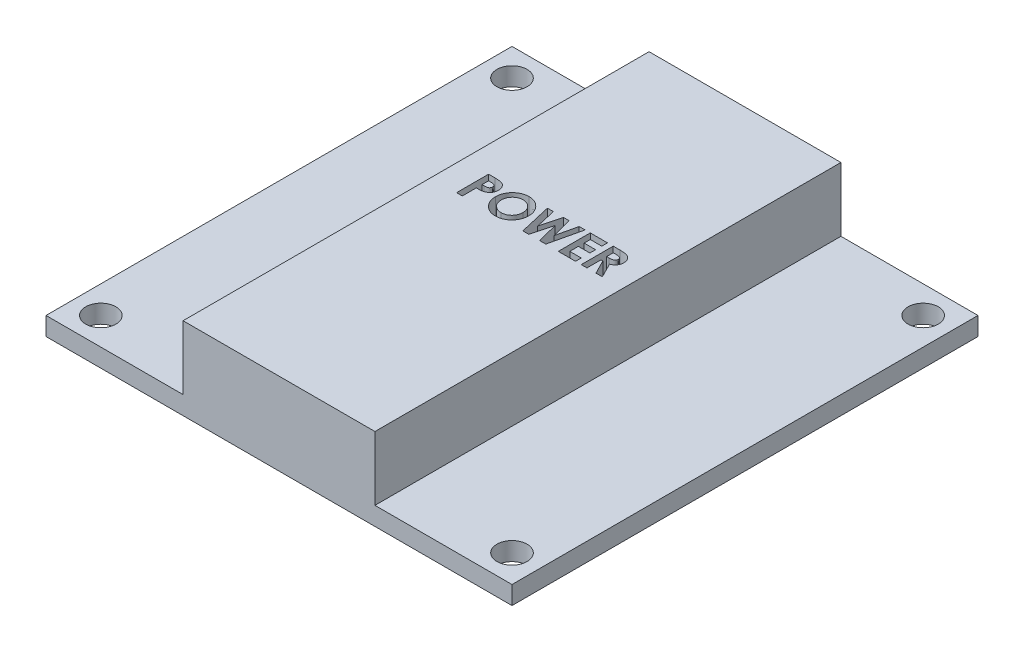
from build123d import *

# Parameters (mm, degrees)
SKETCH1_W           = 51
SKETCH1_H           = 51
SKETCH1_R           = 1.65
BOSS_EXTRUDE1_DEPTH = 9
CUT_EXTRUDE1_DEPTH  = 7
CUT_EXTRUDE2_DEPTH  = 5


with BuildPart() as part:
    # Sketch1 → Boss-Extrude1 (new body)
    with BuildSketch(Plane(origin=(0, 0, 0), x_dir=(1, 0, 0), z_dir=(0, 1, 0))):
        with Locations((5.5, -6.085166225)):
            Rectangle(SKETCH1_W, SKETCH1_H)
        with Locations(Location((-17, 16.414833775, 0), (0, 0, 270))):
            Circle(SKETCH1_R, mode=Mode.SUBTRACT)
        with Locations(Location((28, 16.414833775, 0), (0, 0, 270))):
            Circle(SKETCH1_R, mode=Mode.SUBTRACT)
        with Locations(Location((28, -28.585166225, 0), (0, 0, 270))):
            Circle(SKETCH1_R, mode=Mode.SUBTRACT)
        with Locations(Location((-17, -28.585166225, 0), (0, 0, 270))):
            Circle(SKETCH1_R, mode=Mode.SUBTRACT)
    extrude(amount=BOSS_EXTRUDE1_DEPTH)

    # Sketch2 → Cut-Extrude1 (cut)
    with BuildSketch(Plane(origin=(0, 9, 0), x_dir=(1, 0, 0), z_dir=(0, 1, 0))):
        Polygon((-5, 4.414833775), (-5, -16.585166225), (-5, -31.585166225), (-20, -31.585166225), (-20, 19.414833775), (-5, 19.414833775), align=None)
        Polygon((31, 19.414833775), (31, -31.585166225), (16, -31.585166225), (16, -16.585166225), (16, 4.414833775), (16, 19.414833775), align=None)
    extrude(amount=-CUT_EXTRUDE1_DEPTH, mode=Mode.SUBTRACT)

    # Sketch3 → Cut-Extrude2 (cut)
    # profile 1 of 5: a face of its own
    with BuildSketch(Plane(origin=(0, 9, 0), x_dir=(1, 0, 0), z_dir=(0, 1, 0))):
        with BuildLine():
            Line((-2.170736551, -0.977395332), (-1.469614757, -0.977395332))
            add(Edge.make_bspline(
                [(-1.469614757, -0.977395332), (-1.423804368, -0.977600389), (-1.335426526, -0.977995987), (-1.207978407, -0.98279314), (-1.090401277, -0.991389929), (-0.982722149, -1.002014201), (-0.884985298, -1.016909017), (-0.797068329, -1.033984757), (-0.718952996, -1.054787978), (-0.649758433, -1.079481113), (-0.587658547, -1.108593355), (-0.528892027, -1.139599971), (-0.474787001, -1.176605273), (-0.422612625, -1.215620988), (-0.375351799, -1.26037427), (-0.33005611, -1.307886726), (-0.288643952, -1.360042659), (-0.250923439, -1.416210735), (-0.21670512, -1.47535321), (-0.186809708, -1.537575812), (-0.162560224, -1.602977002), (-0.142217923, -1.671133709), (-0.125878788, -1.742042961), (-0.115002939, -1.816140859), (-0.107615516, -1.892910021), (-0.106963678, -1.945159161), (-0.106633987, -1.971586037)],
                knots=[0, 0, 0, 0, 1.698747864, 3.27724071, 4.728299578, 6.070144658, 7.288476769, 8.393259625, 9.389771311, 10.283485332, 11.113357557, 11.931608583, 12.74405601, 13.541433047, 14.344816069, 15.154114104, 15.974336324, 16.810834471, 17.661136416, 18.50621059, 19.367396281, 20.244825668, 21.142564693, 22.063065223, 23.020325768, 24, 24, 24, 24], degree=3))
            add(Edge.make_bspline(
                [(-0.106633987, -1.971586037), (-0.107111008, -2.000821461), (-0.108048413, -2.058272663), (-0.117237999, -2.142489075), (-0.132936716, -2.2227818), (-0.153454118, -2.29982796), (-0.182064175, -2.372359974), (-0.214749823, -2.442108479), (-0.254963537, -2.507117941), (-0.300914134, -2.56820155), (-0.351097428, -2.625855945), (-0.406704768, -2.678416464), (-0.466676255, -2.726241409), (-0.530664735, -2.769831992), (-0.59891044, -2.809100278), (-0.671364128, -2.844413975), (-0.748520553, -2.87464364), (-0.802249966, -2.890453511), (-0.829490558, -2.89846905)],
                knots=[0, 0, 0, 0, 1.102006807, 2.165578795, 3.188629044, 4.184801286, 5.166646146, 6.124351954, 7.085497154, 8.042432466, 9.003981491, 9.963833307, 10.922997304, 11.89326795, 12.880200226, 13.889073926, 14.929769137, 16, 16, 16, 16], degree=3))
            add(Edge.make_bspline(
                [(-0.829490558, -2.89846905), (-0.847432779, -2.902933104), (-0.886301407, -2.912603681), (-0.950618311, -2.922421745), (-1.02473679, -2.93144885), (-1.108896517, -2.939206555), (-1.203146012, -2.944479986), (-1.307394019, -2.948598302), (-1.421687778, -2.951592743), (-1.501163139, -2.951698998), (-1.542531423, -2.951754306)],
                knots=[0, 0, 0, 0, 0.618981996, 1.340914327, 2.176866532, 3.120127938, 4.170906482, 5.338178032, 6.614476169, 8, 8, 8, 8], degree=3))
            Line((-1.542531423, -2.951754306), (-1.542531423, -4.477395332))
            Line((-1.542531423, -4.477395332), (-2.170736551, -4.477395332))
            Line((-2.170736551, -4.477395332), (-2.170736551, -0.977395332))
        make_face()
        with BuildLine():
            Line((-1.542531423, -2.323549178), (-1.320275814, -2.323549178))
            add(Edge.make_bspline(
                [(-1.320275814, -2.323549178), (-1.279832897, -2.323292739), (-1.205417329, -2.322820886), (-1.103791942, -2.315997625), (-1.022123826, -2.305577128), (-0.957604497, -2.290631724), (-0.906660377, -2.267950096), (-0.862724262, -2.241711723), (-0.825039135, -2.20853402), (-0.792409361, -2.170622818), (-0.766322841, -2.127060947), (-0.748233197, -2.078557727), (-0.736482521, -2.026132263), (-0.735397237, -1.98964761), (-0.734839116, -1.970884915)],
                knots=[0, 0, 0, 0, 1.8619151, 3.425951444, 4.686033666, 5.651700536, 6.461346321, 7.243864085, 7.999046032, 8.762387399, 9.539336099, 10.322741239, 11.137448474, 12, 12, 12, 12], degree=3))
            add(Edge.make_bspline(
                [(-0.734839116, -1.970884915), (-0.735391496, -1.954492194), (-0.736463246, -1.922686373), (-0.744336614, -1.876782684), (-0.756884498, -1.833990976), (-0.775065899, -1.794758152), (-0.798570146, -1.759150875), (-0.827226579, -1.727183173), (-0.86066748, -1.698170428), (-0.886485811, -1.682813539), (-0.899602737, -1.675011518)],
                knots=[0, 0, 0, 0, 1.102301479, 2.1387299, 3.123554645, 4.094223062, 5.036071848, 5.982632524, 6.975082478, 8, 8, 8, 8], degree=3))
            add(Edge.make_bspline(
                [(-0.899602737, -1.675011518), (-0.910713531, -1.669392471), (-0.934237357, -1.657495797), (-0.974300715, -1.643665044), (-1.020533218, -1.631997281), (-1.073246987, -1.622313149), (-1.132231733, -1.614797258), (-1.197476932, -1.609049481), (-1.269078597, -1.606738076), (-1.318873271, -1.605990125), (-1.344815077, -1.60560046)],
                knots=[0, 0, 0, 0, 0.656809284, 1.390599849, 2.23162475, 3.173112763, 4.218524733, 5.370385145, 6.63003504, 8, 8, 8, 8], degree=3))
            Line((-1.344815077, -1.60560046), (-1.542531423, -1.60560046))
            Line((-1.542531423, -1.60560046), (-1.542531423, -2.323549178))
        make_face(mode=Mode.SUBTRACT)
    # profile 2 of 5: a face of its own
    with BuildSketch(Plane(origin=(0, 9, 0), x_dir=(1, 0, 0), z_dir=(0, 1, 0))):
        with BuildLine():
            add(Edge.make_bspline(
                [(2.166402872, -0.887651742), (2.227254661, -0.889227304), (2.347389876, -0.89233782), (2.524065425, -0.918266397), (2.694324984, -0.960513297), (2.858091561, -1.019239543), (3.014955105, -1.09603574), (3.165468925, -1.188724667), (3.309093888, -1.299055771), (3.44435824, -1.424455209), (3.569366897, -1.560821623), (3.677686971, -1.707644311), (3.770058357, -1.86111895), (3.846616008, -2.021656781), (3.90492891, -2.190369603), (3.945849485, -2.366397206), (3.972138927, -2.54968951), (3.975162617, -2.674486586), (3.976699346, -2.737912159)],
                knots=[0, 0, 0, 0, 1.014329547, 2.002516266, 2.970391464, 3.935626869, 4.897733899, 5.877609409, 6.878433252, 7.912639331, 8.949961323, 9.958554974, 10.949718813, 11.932905612, 12.9188844, 13.919928257, 14.942845884, 16, 16, 16, 16], degree=3))
            add(Edge.make_bspline(
                [(3.976699346, -2.737912159), (3.975062796, -2.800623072), (3.971837922, -2.924196939), (3.946922735, -3.105800133), (3.905313052, -3.279942113), (3.847989184, -3.447017054), (3.772819998, -3.606215703), (3.682249956, -3.75855452), (3.573889083, -3.902619766), (3.451689729, -4.038334129), (3.317158844, -4.161524034), (3.174669281, -4.270084925), (3.024878968, -4.362075328), (2.868007151, -4.437453105), (2.703717424, -4.495951022), (2.532415604, -4.537225554), (2.354112292, -4.56230892), (2.232857392, -4.565512729), (2.171310724, -4.567138922)],
                knots=[0, 0, 0, 0, 1.051557043, 2.072126891, 3.067553643, 4.050577992, 5.02905126, 6.015227836, 7.017913613, 8.04756643, 9.074058332, 10.072836633, 11.047628519, 12.017157415, 12.98668631, 13.966869689, 14.968021931, 16, 16, 16, 16], degree=3))
            add(Edge.make_bspline(
                [(2.171310724, -4.567138922), (2.106940289, -4.565680147), (1.980461182, -4.562813854), (1.795358443, -4.535556715), (1.618014025, -4.494497941), (1.449917724, -4.433219924), (1.28935762, -4.356617251), (1.137513399, -4.262276466), (0.994436087, -4.150353474), (0.860946402, -4.023714666), (0.740004423, -3.885144034), (0.633249404, -3.73875645), (0.543199178, -3.585670185), (0.469850449, -3.425813593), (0.412025257, -3.260180143), (0.371236155, -3.08776108), (0.347141059, -2.908969927), (0.343784752, -2.787531402), (0.342083961, -2.725993088)],
                knots=[0, 0, 0, 0, 1.067978421, 2.098431617, 3.099715153, 4.085208694, 5.062210972, 6.048429807, 7.046490867, 8.072918869, 9.098532598, 10.095778865, 11.076610158, 12.041847152, 13.011192615, 13.984257998, 14.978533688, 16, 16, 16, 16], degree=3))
            add(Edge.make_bspline(
                [(0.342083961, -2.725993088), (0.342617767, -2.684593333), (0.34367862, -2.602318038), (0.356457709, -2.48039025), (0.374855923, -2.360842329), (0.402066009, -2.244150914), (0.435119309, -2.129492802), (0.477944528, -2.017935258), (0.526691216, -1.908286541), (0.583647132, -1.801841739), (0.646976603, -1.699580235), (0.716074694, -1.601984413), (0.791115152, -1.510234349), (0.871856247, -1.4237271), (0.958576222, -1.343031284), (1.050134367, -1.267004539), (1.148306376, -1.197666407), (1.250943572, -1.133323512), (1.35746731, -1.075139348), (1.467443942, -1.025614727), (1.578607731, -0.982365719), (1.692443677, -0.94823169), (1.807731825, -0.92042988), (1.925703795, -0.902044067), (2.045293777, -0.889265332), (2.125937368, -0.888190882), (2.166402872, -0.887651742)],
                knots=[0, 0, 0, 0, 1.034744296, 2.056386356, 3.06226378, 4.057406941, 5.050368692, 6.043467995, 7.042652155, 8.049140477, 9.059438543, 10.048523776, 11.036952808, 12.020949711, 13.004946614, 13.997082645, 14.994316842, 16.007702937, 17.024872941, 18.026463647, 19.021641123, 20.005082605, 20.995858141, 21.984425357, 22.988620895, 24, 24, 24, 24], degree=3))
        make_face()
        with BuildLine():
            add(Edge.make_bspline(
                [(2.156587166, -1.515856871), (2.11563392, -1.516955738), (2.0348086, -1.519124463), (1.916252575, -1.535647213), (1.802434604, -1.562035922), (1.693985626, -1.600259645), (1.590435612, -1.648908744), (1.491601001, -1.707813232), (1.398850448, -1.778997885), (1.310947214, -1.858641117), (1.231541106, -1.94738198), (1.161383305, -2.042482907), (1.102672526, -2.143785081), (1.053501881, -2.250347428), (1.016487282, -2.363368214), (0.990122894, -2.481962135), (0.973461584, -2.606333534), (0.971361406, -2.691117355), (0.97028909, -2.73440655)],
                knots=[0, 0, 0, 0, 1.033739768, 2.040188636, 3.016340934, 3.979330865, 4.937572243, 5.900995986, 6.878200029, 7.884839167, 8.891893314, 9.879764717, 10.863503415, 11.843163062, 12.837761627, 13.859916423, 14.907309254, 16, 16, 16, 16], degree=3))
            add(Edge.make_bspline(
                [(0.97028909, -2.73440655), (0.971710817, -2.782380716), (0.974497167, -2.876402134), (0.994102264, -3.013558044), (1.027644634, -3.143088188), (1.076079164, -3.264359054), (1.136150689, -3.378717264), (1.210749988, -3.484761196), (1.298668907, -3.58312579), (1.36640093, -3.640555137), (1.400777872, -3.669703024)],
                knots=[0, 0, 0, 0, 1.078454662, 2.113592447, 3.107694534, 4.079536787, 5.043276885, 6.005368276, 6.987637804, 8, 8, 8, 8], degree=3))
            add(Edge.make_bspline(
                [(1.400777872, -3.669703024), (1.42893915, -3.691236364), (1.484627229, -3.733817893), (1.573517527, -3.788394858), (1.66505703, -3.835172761), (1.759936519, -3.872968754), (1.857955614, -3.902698446), (1.959100873, -3.923517661), (2.063228981, -3.936583519), (2.133645288, -3.938145136), (2.169207359, -3.938933794)],
                knots=[0, 0, 0, 0, 1.023928204, 2.024787132, 3.009472467, 3.9914905, 4.972207045, 5.96565515, 6.972602802, 8, 8, 8, 8], degree=3))
            add(Edge.make_bspline(
                [(2.169207359, -3.938933794), (2.209456413, -3.937825609), (2.288647693, -3.935645221), (2.404996734, -3.919325875), (2.516462648, -3.89170765), (2.623737427, -3.853819239), (2.726511737, -3.804559309), (2.824283292, -3.743827788), (2.917223513, -3.672370383), (3.00501476, -3.591681261), (3.085260109, -3.50259082), (3.155271505, -3.406982634), (3.215848994, -3.306963239), (3.263997135, -3.20111701), (3.302474097, -3.090443087), (3.328521176, -2.97445132), (3.345323236, -2.853619869), (3.347424006, -2.771389797), (3.348494218, -2.729498697)],
                knots=[0, 0, 0, 0, 1.026359118, 2.019393844, 2.989460624, 3.950973911, 4.916101784, 5.890408035, 6.881132271, 7.902007068, 8.92769091, 9.933912415, 10.920395702, 11.90457117, 12.894218921, 13.903490204, 14.931958862, 16, 16, 16, 16], degree=3))
            add(Edge.make_bspline(
                [(3.348494218, -2.729498697), (3.347386977, -2.687848484), (3.345207541, -2.60586639), (3.328859473, -2.485345596), (3.301416395, -2.369865898), (3.263414209, -2.259238705), (3.21488743, -2.153355561), (3.154879144, -2.052588815), (3.083599914, -1.957035883), (3.002690226, -1.867347922), (2.914625004, -1.784930431), (2.820078189, -1.71340703), (2.721695306, -1.651255469), (2.617218973, -1.602568446), (2.508786687, -1.563779598), (2.39573679, -1.535214933), (2.277641098, -1.519240536), (2.197298156, -1.516994813), (2.156587166, -1.515856871)],
                knots=[0, 0, 0, 0, 1.055025985, 2.07665775, 3.074803781, 4.057872707, 5.035505728, 6.020516407, 7.023567878, 8.050795229, 9.077271434, 10.074415901, 11.050397877, 12.019801805, 12.988065821, 13.964604439, 14.968634123, 16, 16, 16, 16], degree=3))
        make_face(mode=Mode.SUBTRACT)
    # profile 3 of 5: a face of its own
    with BuildSketch(Plane(origin=(0, 9, 0), x_dir=(1, 0, 0), z_dir=(0, 1, 0))):
        Polygon((4.268366013, -0.977395332), (4.916903673, -0.977395332), (5.435032679, -3.211870492), (6.02888284, -0.977395332), (6.639559923, -0.977395332), (7.229904474, -3.211870492), (7.746631237, -0.977395332), (8.396571141, -0.977395332), (7.586775468, -4.477395332), (6.930525468, -4.477395332), (6.332468577, -2.2148753), (5.730906077, -4.477395332), (5.079563929, -4.477395332), align=None)
    # profile 4 of 5: a face of its own
    with BuildSketch(Plane(origin=(0, 9, 0), x_dir=(1, 0, 0), z_dir=(0, 1, 0))):
        Polygon((8.957468577, -0.977395332), (10.842083961, -0.977395332), (10.842083961, -1.60560046), (9.585673705, -1.60560046), (9.585673705, -2.278677383), (10.842083961, -2.278677383), (10.842083961, -2.906882512), (9.585673705, -2.906882512), (9.585673705, -3.849190204), (10.842083961, -3.849190204), (10.842083961, -4.477395332), (8.957468577, -4.477395332), align=None)
    # profile 5 of 5: a face of its own
    with BuildSketch(Plane(origin=(0, 9, 0), x_dir=(1, 0, 0), z_dir=(0, 1, 0))):
        with BuildLine():
            Line((11.47028909, -0.977395332), (12.202260243, -0.977395332))
            add(Edge.make_bspline(
                [(12.202260243, -0.977395332), (12.250643314, -0.977567064), (12.343697587, -0.977897353), (12.477876767, -0.983108443), (12.601138796, -0.990360102), (12.713666175, -1.001426326), (12.815410763, -1.016098802), (12.906474532, -1.033395223), (12.98685482, -1.053108202), (13.057229525, -1.07767213), (13.120739215, -1.105379869), (13.179939076, -1.137216568), (13.236135145, -1.172827717), (13.288951811, -1.213150341), (13.338848064, -1.257459046), (13.385918036, -1.305798433), (13.429496585, -1.3585784), (13.46931387, -1.415465445), (13.505604121, -1.475309312), (13.537677091, -1.538192167), (13.563758883, -1.60415774), (13.586804943, -1.672252687), (13.603404273, -1.743450438), (13.614948864, -1.817057871), (13.623401362, -1.893334092), (13.623887341, -1.94515277), (13.624135243, -1.971586037)],
                knots=[0, 0, 0, 0, 1.749336639, 3.364467119, 4.854658419, 6.213483162, 7.451590619, 8.570285859, 9.5643256, 10.440900261, 11.26203566, 12.067320669, 12.869050712, 13.665104639, 14.467235401, 15.27997916, 16.102287765, 16.939272006, 17.78853747, 18.631303466, 19.488103222, 20.351255419, 21.228522269, 22.127379805, 23.044756219, 24, 24, 24, 24], degree=3))
            add(Edge.make_bspline(
                [(13.624135243, -1.971586037), (13.623491281, -1.999176296), (13.622228589, -2.053275764), (13.61542704, -2.132743471), (13.602995946, -2.208772615), (13.584167246, -2.281140591), (13.5625261, -2.350748103), (13.533748927, -2.41631085), (13.501271044, -2.478782346), (13.462698011, -2.537278908), (13.420365991, -2.593099863), (13.371134743, -2.644106501), (13.318193695, -2.693040238), (13.258566837, -2.736836029), (13.194882578, -2.778455187), (13.125875578, -2.816173229), (13.0519962, -2.850938297), (13.000055338, -2.870325701), (12.973494218, -2.880239883)],
                knots=[0, 0, 0, 0, 1.099860209, 2.156625411, 3.176576793, 4.16617041, 5.135385252, 6.078461593, 7.016046972, 7.938469504, 8.868247731, 9.803980173, 10.76021508, 11.73834243, 12.748633912, 13.790971185, 14.870363756, 16, 16, 16, 16], degree=3))
            Line((12.973494218, -2.880239883), (13.781186525, -4.477395332))
            Line((13.781186525, -4.477395332), (13.082869218, -4.477395332))
            Line((13.082869218, -4.477395332), (12.311635243, -2.951754306))
            Line((12.311635243, -2.951754306), (12.098494218, -2.951754306))
            Line((12.098494218, -2.951754306), (12.098494218, -4.477395332))
            Line((12.098494218, -4.477395332), (11.47028909, -4.477395332))
            Line((11.47028909, -4.477395332), (11.47028909, -0.977395332))
        make_face()
        with BuildLine():
            Line((12.098494218, -2.323549178), (12.343185724, -2.323549178))
            add(Edge.make_bspline(
                [(12.343185724, -2.323549178), (12.373101295, -2.323212249), (12.430383185, -2.322567102), (12.512762066, -2.319574642), (12.587581736, -2.312364292), (12.655163496, -2.303254285), (12.715847412, -2.292735466), (12.769092204, -2.27766136), (12.815718294, -2.261509074), (12.85517316, -2.241435972), (12.888882491, -2.218608501), (12.91798834, -2.192675927), (12.942063051, -2.162662274), (12.961877766, -2.129383185), (12.97729146, -2.092544313), (12.988542276, -2.052550067), (12.994829818, -2.00894486), (12.995553222, -1.97885133), (12.995930115, -1.963172576)],
                knots=[0, 0, 0, 0, 1.688639943, 3.233382647, 4.650958383, 5.928841754, 7.082724185, 8.122798841, 9.049171256, 9.863274652, 10.613301712, 11.341792392, 12.054588806, 12.776240173, 13.521029143, 14.301969904, 15.115324896, 16, 16, 16, 16], degree=3))
            add(Edge.make_bspline(
                [(12.995930115, -1.963172576), (12.995217563, -1.944623465), (12.993817887, -1.908187173), (12.979928749, -1.855731689), (12.957820243, -1.80718055), (12.927515535, -1.762753122), (12.889350697, -1.723804972), (12.845553533, -1.689471867), (12.795178796, -1.662323816), (12.74853558, -1.644417251), (12.706101156, -1.633703569), (12.667805427, -1.625719827), (12.623458742, -1.62006152), (12.573027623, -1.614059879), (12.516640619, -1.610168118), (12.453990387, -1.607327909), (12.38525686, -1.606165839), (12.337343063, -1.605794346), (12.312336365, -1.60560046)],
                knots=[0, 0, 0, 0, 1.020303359, 2.004196876, 2.966617323, 3.9489082, 4.950758222, 5.960522915, 7.003732012, 8.091992268, 8.70421221, 9.413913587, 10.24622431, 11.166358409, 12.212345909, 13.359657661, 14.621978493, 16, 16, 16, 16], degree=3))
            Line((12.312336365, -1.60560046), (12.098494218, -1.60560046))
            Line((12.098494218, -1.60560046), (12.098494218, -2.323549178))
        make_face(mode=Mode.SUBTRACT)
    extrude(amount=-CUT_EXTRUDE2_DEPTH, mode=Mode.SUBTRACT)


solid = part.part
